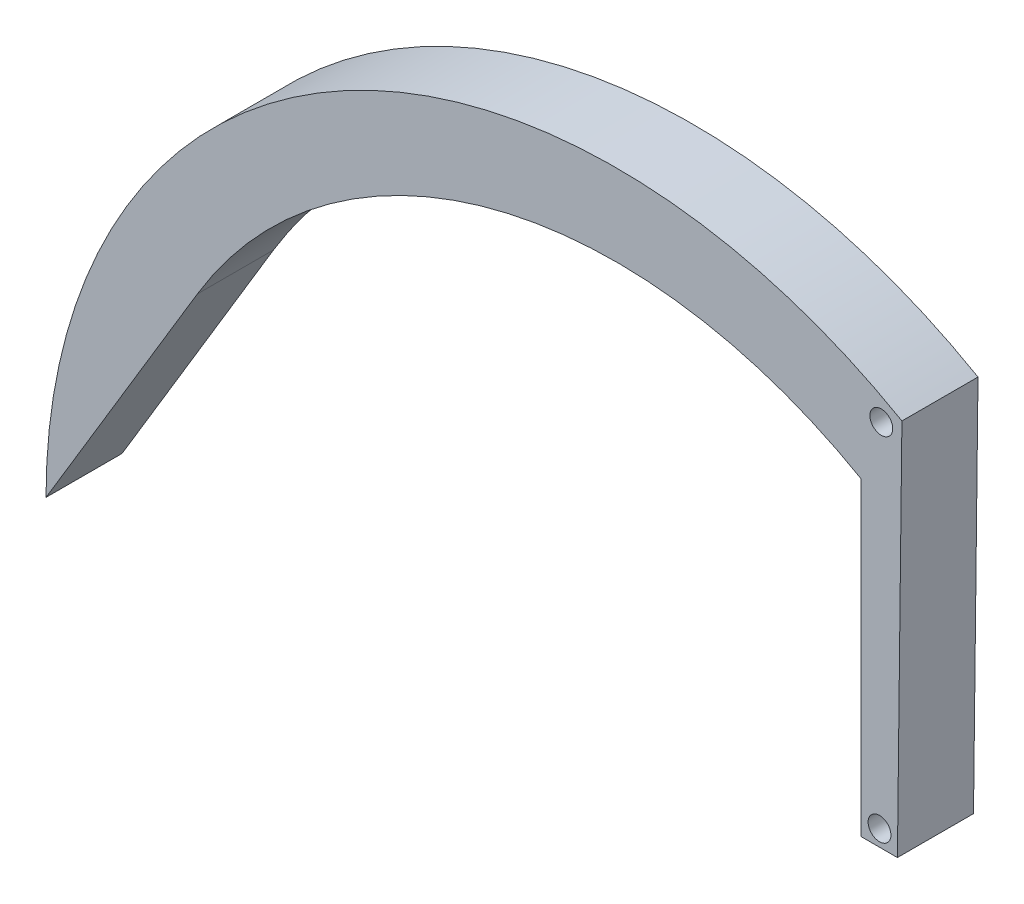
from build123d import *

# Parameters (mm, degrees)
EXTRUDE_2_DEPTH     = 20
SKETCH_10_R         = 3
CUT_EXTRUDE_1_DEPTH = 214.072757527
SKETCH_11_R         = 3
CUT_EXTRUDE_2_DEPTH = 214.072757527


with BuildPart() as part:
    # 草图9 → 凸台-拉伸2 (new body)
    with BuildSketch(Plane.XY):
        with BuildLine():
            Line((-150, 0), (-110.203390468, 66.224778592))
            ThreePointArc((-110.203390468, 66.224778592), (-32.188335395, 124.476582676), (64.285512696, 111.345774179))
            Line((64.285512696, 111.345774179), (64.285512696, 29.910799468))
            Line((64.285512696, 29.910799468), (73.817743163, 29.910799468))
            Line((73.817743163, 29.910799468), (75, 129.903810568))
            ThreePointArc((75, 129.903810568), (-75, 129.903810568), (-150, 0))
        make_face()
    extrude(amount=EXTRUDE_2_DEPTH)

    # 草图10 → 切除-拉伸1 (cut, through all)
    with BuildSketch(Plane.XY.offset(20)):
        with Locations((69.588650595, 126.928706674)):
            Circle(SKETCH_10_R)
    extrude(amount=-CUT_EXTRUDE_1_DEPTH, mode=Mode.SUBTRACT)

    # 草图11 → 切除-拉伸2 (cut, through all)
    with BuildSketch(Plane.XY.offset(20)):
        with Locations((69.114412229, 34.162597533)):
            Circle(SKETCH_11_R)
    extrude(amount=-CUT_EXTRUDE_2_DEPTH, mode=Mode.SUBTRACT)


solid = part.part
